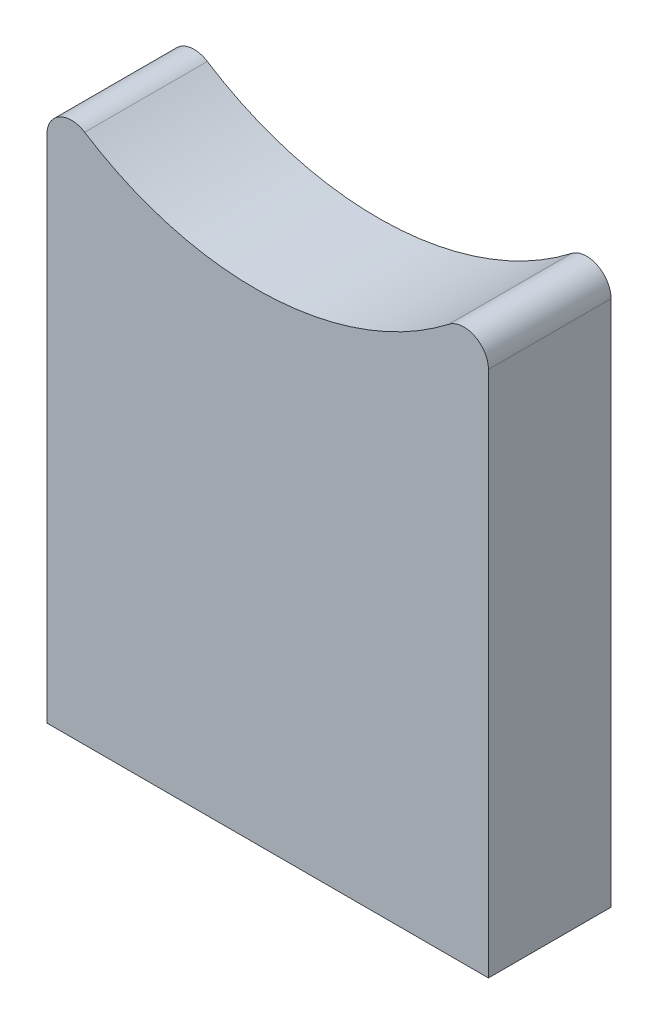
from build123d import *

# Parameters (mm, degrees)
ESTRUSIONE_ESTRUSIONE1_DEPTH = 10
RACCORDO1_R                  = 2


with BuildPart() as part:
    # Schizzo1 → Estrusione-Estrusione1 (new body)
    with BuildSketch(Plane.XY):
        with BuildLine():
            Line((-18, 0), (-18, 45.576734941))
            ThreePointArc((-18, 45.576734941), (0.394139103, 39.209366163), (18, 47.511257547))
            Line((18, 47.511257547), (18, 0))
            Line((18, 0), (-18, 0))
        make_face()
    extrude(amount=ESTRUSIONE_ESTRUSIONE1_DEPTH)

    # Raccordo1
    raccordo1_edges = [part.edges().sort_by_distance(p)[0] for p in [
        (-18, 45.576734941, 5),
        (18, 47.511257547, 5),
    ]]
    fillet(raccordo1_edges, radius=RACCORDO1_R)


solid = part.part
